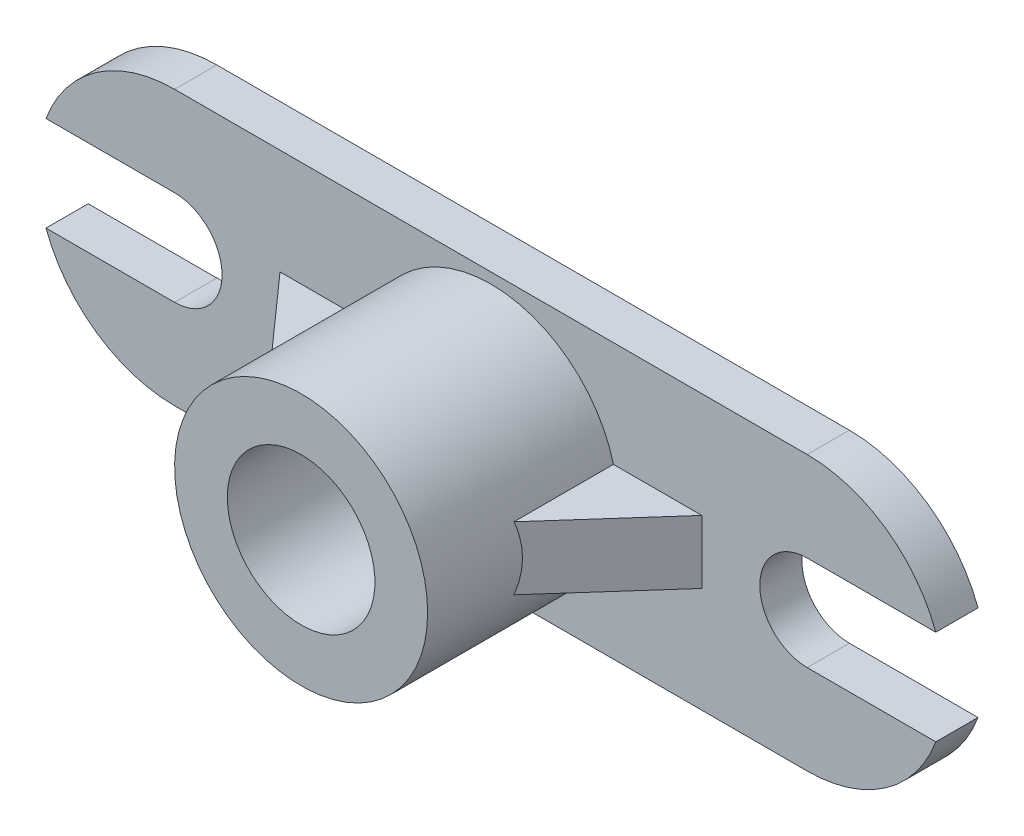
from build123d import *

# Parameters (mm, degrees)
SKETCH_1_R               = 6
EXTRUDE_1_DEPTH          = 2
SKETCH_1_3_R             = 6
SKETCH_1_3_R_2           = 3.5
EXTRUDE_2_DEPTH          = 11
RIB_1_REACH              = 40.293
SKETCH_2_WALL_W          = 84.606091636
SKETCH_2_WALL_H          = 3
PATTERN_CIRCULAR_1_COUNT = 2


with BuildPart() as part:
    # Эскиз1 → Бобышка-Вытянуть1 (new body)
    with BuildSketch(Plane.XY):
        with BuildLine():
            Line((30, 6.5), (0, 6.5))
            ThreePointArc((0, 6.5), (-3.716517187, 5.332682252), (-6.098155459, 2.25))
            Line((-6.098155459, 2.25), (0, 2.25))
            ThreePointArc((0, 2.25), (2.25, 0), (0, -2.25))
            Line((0, -2.25), (-6.098155459, -2.25))
            ThreePointArc((-6.098155459, -2.25), (-3.716517187, -5.332682252), (0, -6.5))
            Line((0, -6.5), (30, -6.5))
            ThreePointArc((30, -6.5), (33.716517187, -5.332682252), (36.098155459, -2.25))
            Line((36.098155459, -2.25), (30, -2.25))
            ThreePointArc((30, -2.25), (27.75, 0), (30, 2.25))
            Line((30, 2.25), (36.098155459, 2.25))
            ThreePointArc((36.098155459, 2.25), (33.716517187, 5.332682252), (30, 6.5))
        make_face()
        with Locations((15, 0)):
            Circle(SKETCH_1_R, mode=Mode.SUBTRACT)
    extrude(amount=EXTRUDE_1_DEPTH)

    # Эскиз1<3> → Бобышка-Вытянуть2 (add)
    with BuildSketch(Plane.XY):
        with Locations((15, 0)):
            Circle(SKETCH_1_3_R)
        with Locations((15, 0)):
            Circle(SKETCH_1_3_R_2, mode=Mode.SUBTRACT)
    extrude(amount=EXTRUDE_2_DEPTH)

    # Эскиз2 wall → Ребро1 (add, up to next)
    with BuildSketch(Plane(origin=(7, 0, 4.25), x_dir=(0.66436383883, 0, 0.747409318684), z_dir=(0.747409318684, 0, -0.66436383883)), mode=Mode.PRIVATE) as rib_1_sk1:
        Rectangle(SKETCH_2_WALL_W, SKETCH_2_WALL_H)
    rib_1_tool1 = extrude(rib_1_sk1.sketch, amount=RIB_1_REACH, mode=Mode.PRIVATE) - part.part
    rib_1 = rib_1_tool1.solids().sort_by_distance((7, 0, 4.25))[0]
    add(rib_1)

    # Круговой массив1: Ребро1 ×2 about axis
    pattern_circular_1_axis = Axis((15, 0, 11), (0, 0, -1))
    for i in range(1, PATTERN_CIRCULAR_1_COUNT):
        add(rib_1.rotate(pattern_circular_1_axis, i * 360 / PATTERN_CIRCULAR_1_COUNT))


solid = part.part
